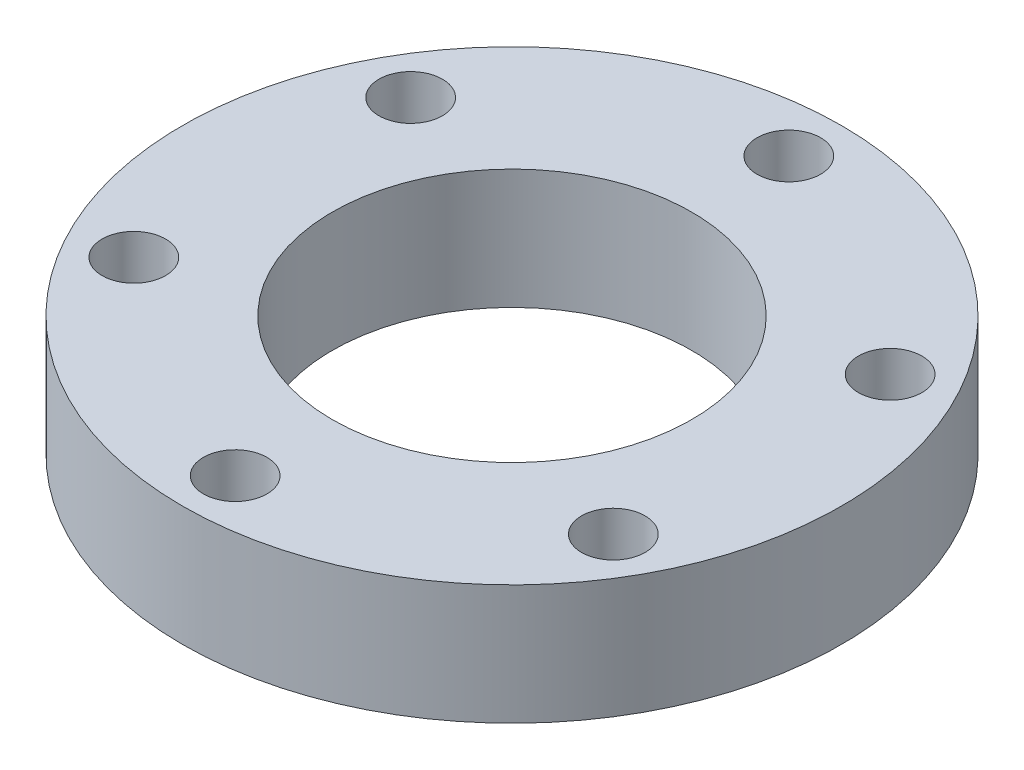
from build123d import *

# Parameters (mm, degrees)
SKETCH1_R          = 34.925
EXTRUDE1_DEPTH     = 12.7
SKETCH2_R          = 19.05
CUT_EXTRUDE1_DEPTH = 51.998051433
SKETCH3_R          = 3.3655
CUT_EXTRUDE2_DEPTH = 51.998051433
CIRPATTERN1_COUNT  = 6


with BuildPart() as part:
    # Sketch1 → Extrude1 (new body)
    with BuildSketch(Plane(origin=(0, 0, 0), x_dir=(1, 0, 0), z_dir=(0, 1, 0))):
        Circle(SKETCH1_R)
    extrude(amount=EXTRUDE1_DEPTH)

    # Sketch2 → Cut-Extrude1 (cut, through all)
    with BuildSketch(Plane(origin=(0, 0, 0), x_dir=(1, 0, 0), z_dir=(0, 1, 0))):
        Circle(SKETCH2_R)
    extrude(amount=CUT_EXTRUDE1_DEPTH, mode=Mode.SUBTRACT)

    # Sketch3 → Cut-Extrude2 (cut, through all)
    with BuildSketch(Plane(origin=(0, 0, 0), x_dir=(1, 0, 0), z_dir=(0, 1, 0))):
        with Locations((0, 29.337)):
            Circle(SKETCH3_R)
    cut_extrude2 = extrude(amount=CUT_EXTRUDE2_DEPTH, mode=Mode.SUBTRACT)

    # CirPattern1: Cut-Extrude2 ×6 about axis
    cirpattern1_axis = Axis((0, 35.858162691, 0), (0, -1, 0))
    for i in range(1, CIRPATTERN1_COUNT):
        add(cut_extrude2.rotate(cirpattern1_axis, i * 360 / CIRPATTERN1_COUNT), mode=Mode.SUBTRACT)


solid = part.part
